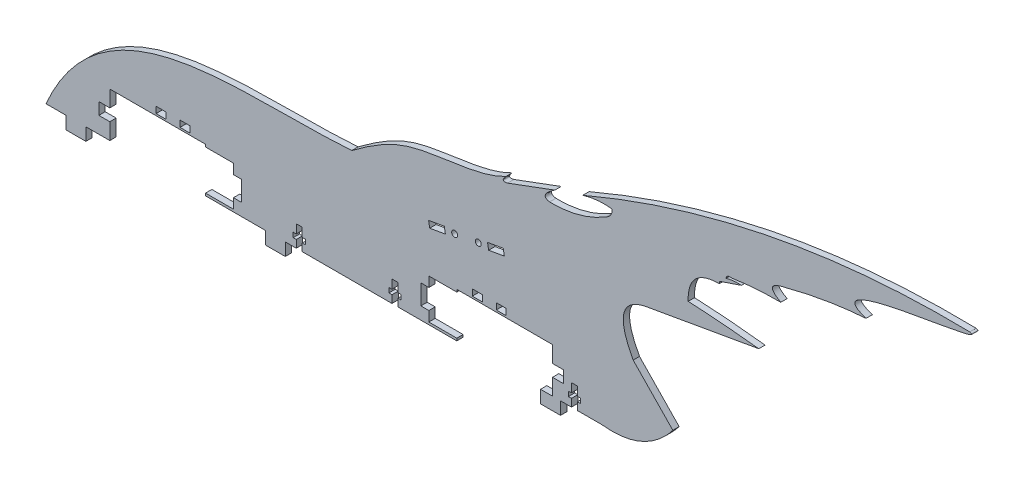
from build123d import *

# Parameters (mm, degrees)
BOSS_EXTRUDE1_DEPTH = 3.175
SKETCH3_W           = 10
SKETCH3_H           = 6.35
BOSS_EXTRUDE2_DEPTH = 3.175
CUT_EXTRUDE1_DEPTH  = 1
CUT_EXTRUDE2_DEPTH  = 309.914260869
SKETCH7_W           = 5
SKETCH7_H           = 3.175
CUT_EXTRUDE3_DEPTH  = 309.914260869
SKETCH8_R           = 1.5
CUT_EXTRUDE4_DEPTH  = 309.914260869


with BuildPart() as part:
    # Sketch2 → Boss-Extrude1 (new body)
    with BuildSketch(Plane.XY):
        with BuildLine():
            Line((-171.469047232, -34.076589663), (107.072734851, -34.076589663))
            add(Edge.make_bspline(
                [(107.072734851, -34.076589663), (128.968224532, -36.583015685), (142.892082906, -18.715522774)],
                knots=[0, 0, 0, 1, 1, 1], degree=2))
            Line((142.892082906, -18.715522774), (122.99960361, 1.8225486))
            add(Edge.make_bspline(
                [(129.812103759, 28.346921979), (110.367502019, 24.835662341), (122.99960361, 1.8225486)],
                knots=[0, 0, 0, 1, 1, 1], degree=2))
            Line((129.812103759, 28.346921979), (185.982982819, 38.244685161))
            add(Edge.make_bspline(
                [(150.588622768, 41.132714976), (168.332466646, 40.241827569), (185.982982819, 38.244685161)],
                knots=[0, 0, 0, 1, 1, 1], degree=2))
            add(Edge.make_bspline(
                [(166.211544782, 56.600045126), (150.111599454, 56.448151942), (150.588622768, 41.132714976)],
                knots=[0, 0, 0, 1, 1, 1], degree=2))
            Line((166.211544782, 56.600045126), (166.232711914, 57.669663084))
            Line((166.232711914, 57.669663084), (177.243348067, 61.403308501))
            add(Edge.make_bspline(
                [(177.243348067, 61.403308501), (173.339529375, 61.796609349), (169.627135034, 60.610840144)],
                knots=[0, 0, 0, 1, 1, 1], degree=2))
            add(Edge.make_bspline(
                [(169.627135034, 60.610840144), (169.762853876, 62.544945332), (172.402329475, 62.156522878)],
                knots=[0, 0, 0, 1, 1, 1], degree=2))
            add(Edge.make_bspline(
                [(172.402329475, 62.156522878), (184.617311888, 64.041519989), (197.029812567, 63.947302758)],
                knots=[0, 0, 0, 1, 1, 1], degree=2))
            add(Edge.make_bspline(
                [(197.029812567, 63.947302758), (187.73474396, 69.069639789), (198.964387884, 71.402059066)],
                knots=[0, 0, 0, 1, 1, 1], degree=2))
            add(Edge.make_bspline(
                [(198.964387884, 71.402059066), (219.003547299, 76.786528717), (239.76459105, 78.329887141)],
                knots=[0, 0, 0, 1, 1, 1], degree=2))
            add(Edge.make_bspline(
                [(291.780939868, 98.47138823), (303.090852198, 95.717715254), (210.844028254, 88.026417155), (239.76459105, 78.329887141)],
                knots=[0, 0, 0, 0, 1, 1, 1, 1], degree=3))
            add(Edge.make_bspline(
                [(291.780939868, 98.47138823), (190.608851514, 100.539390251), (97.737935683, 60.775941524)],
                knots=[0, 0, 0, 1, 1, 1], degree=2))
            add(Edge.make_bspline(
                [(97.737935683, 60.775941524), (104.92881908, 63.001143493), (112.379572637, 62.156522878)],
                knots=[0, 0, 0, 1, 1, 1], degree=2))
            add(Edge.make_bspline(
                [(112.379572637, 62.156522878), (112.730110756, 59.051830939), (109.55036868, 57.311722682)],
                knots=[0, 0, 0, 1, 1, 1], degree=2))
            add(Edge.make_bspline(
                [(109.55036868, 57.311722682), (96.530025853, 49.246897899), (81.058579137, 49.55282081)],
                knots=[0, 0, 0, 1, 1, 1], degree=2))
            add(Edge.make_bspline(
                [(81.058579137, 49.55282081), (75.642299748, 50.628036984), (83.696612356, 55.998318906)],
                knots=[0, 0, 0, 1, 1, 1], degree=2))
            Line((83.696612356, 55.998318906), (60.023408157, 47.198036308))
            add(Edge.make_bspline(
                [(60.023408157, 47.198036308), (56.150260782, 46.24516321), (59.12376331, 49.613311176)],
                knots=[0, 0, 0, 1, 1, 1], degree=2))
            add(Edge.make_bspline(
                [(59.12376331, 49.613311176), (44.292473838, 41.921501166), (13.209344651, 43.405332099), (-7.707186428, 29.993825045), (-18.106560521, 22.301338951)],
                knots=[0, 0, 0, 0, 0.606338938, 1, 1, 1, 1], degree=3))
            add(Edge.make_bspline(
                [(-18.106560521, 22.301338951), (-73.30010729, 18.178725753), (-142.381543794, 32.928841514), (-171.469047232, -34.076589663)],
                knots=[0, 0, 0, 0, 1, 1, 1, 1], degree=3))
        make_face()
    extrude(amount=BOSS_EXTRUDE1_DEPTH)

    # Sketch3 → Boss-Extrude2 (add)
    with BuildSketch(Plane.XY.offset(3.175)):
        with Locations((-156.469047232, -37.251589663)):
            Rectangle(SKETCH3_W, SKETCH3_H)
        with Locations((-56.469047232, -37.251589663)):
            Rectangle(SKETCH3_W, SKETCH3_H)
        with Locations((81.530952768, -37.251589663)):
            Rectangle(SKETCH3_W, SKETCH3_H)
    extrude(amount=-BOSS_EXTRUDE2_DEPTH)

    # Sketch4 → Cut-Extrude1 (cut)
    with BuildSketch(Plane.XY):
        with BuildLine():
            Line((-8.735344321, 21.076667257), (49.27249451, 25.443679203))
            add(Edge.make_bspline(
                [(55.435775055, 40.720887474), (56.710717132, 34.955549426), (51.7521577, 29.95185464), (49.27249451, 25.443679203)],
                knots=[0, 0, 0, 0, 1, 1, 1, 1], degree=3))
            add(Edge.make_bspline(
                [(55.435775055, 40.720887474), (33.054612951, 40.360145045), (7.874054379, 39.272954497), (-8.735344321, 21.076667257)],
                knots=[0, 0, 0, 0, 1, 1, 1, 1], degree=3))
        make_face()
    extrude(amount=CUT_EXTRUDE1_DEPTH, mode=Mode.SUBTRACT)

    # Sketch5 → Cut-Extrude2 (cut, through all)
    with BuildSketch(Plane.XY.offset(3.175)):
        Polygon((-45.969047232, -34.076589663), (-42.969047232, -34.076589663), (-42.969047232, -30.276589663), (-41.419047232, -30.276589663), (-41.419047232, -27.876589663), (-42.969047232, -27.876589663), (-42.969047232, -23.426589663), (-45.969047232, -23.426589663), (-45.969047232, -27.876589663), (-47.519047232, -27.876589663), (-47.519047232, -30.276589663), (-45.969047232, -30.276589663), align=None)
        Polygon((2.030952768, -30.276589663), (2.030952768, -34.076589663), (5.030952768, -34.076589663), (5.030952768, -30.276589663), (6.580952768, -30.276589663), (6.580952768, -27.876589663), (5.030952768, -27.876589663), (5.030952768, -23.426589663), (2.030952768, -23.426589663), (2.030952768, -27.876589663), (0.480952768, -27.876589663), (0.480952768, -30.276589663), align=None)
        Polygon((92.030952768, -30.276589663), (92.030952768, -34.076589663), (95.030952768, -34.076589663), (95.030952768, -30.276589663), (96.580952768, -30.276589663), (96.580952768, -27.876589663), (95.030952768, -27.876589663), (95.030952768, -23.426589663), (92.030952768, -23.426589663), (92.030952768, -27.876589663), (90.480952768, -27.876589663), (90.480952768, -30.276589663), align=None)
    extrude(amount=-CUT_EXTRUDE2_DEPTH, mode=Mode.SUBTRACT)

    # Sketch7 → Cut-Extrude3 (cut, through all)
    with BuildSketch(Plane.XY.offset(3.175)):
        Polygon((-91.469047232, -32.876589663), (-77.469047232, -32.876589663), (-77.469047232, -27.876589663), (-73.469047232, -27.876589663), (-73.469047232, -17.876589663), (-77.469047232, -17.876589663), (-77.469047232, -12.876589663), (-91.469047232, -12.876589663), (-91.469047232, -11.676589663), (-139.469047232, -11.676589663), (-139.469047232, -19.876589663), (-144.969047232, -19.876589663), (-144.969047232, -25.876589663), (-139.469047232, -25.876589663), (-139.469047232, -34.076589663), (-91.469047232, -34.076589663), align=None)
        Polygon((20.530952768, -27.876589663), (20.530952768, -32.876589663), (34.530952768, -32.876589663), (34.530952768, -34.076589663), (82.530952768, -34.076589663), (82.530952768, -25.876589663), (88.030952768, -25.876589663), (88.030952768, -19.876589663), (82.530952768, -19.876589663), (82.530952768, -11.676589663), (34.530952768, -11.676589663), (34.530952768, -12.876589663), (20.530952768, -12.876589663), (20.530952768, -17.876589663), (16.530952768, -17.876589663), (16.530952768, -27.876589663), align=None)
        with Locations((-113.769047232, -9.149089663)):
            Rectangle(SKETCH7_W, SKETCH7_H)
        with Locations((-101.769047232, -9.149089663)):
            Rectangle(SKETCH7_W, SKETCH7_H)
        with Locations((44.830952768, -9.149089663)):
            Rectangle(SKETCH7_W, SKETCH7_H)
        with Locations((56.830952768, -9.149089663)):
            Rectangle(SKETCH7_W, SKETCH7_H)
    extrude(amount=-CUT_EXTRUDE3_DEPTH, mode=Mode.SUBTRACT)

    # Sketch8 → Cut-Extrude4 (cut, through all)
    with BuildSketch(Plane(origin=(0, 0, 0), x_dir=(-1, 0, 0), z_dir=(0, 0, -1))):
        with Locations((-33.483463602, 11.904038041)):
            Circle(SKETCH8_R)
        with Locations(Location((-45.301156639, 13.987816173, 0), (0, 0, 180))):
            Circle(SKETCH8_R)
        Polygon((-20.405296331, 11.209994039), (-20.956629295, 8.083229423), (-28.835091319, 9.472414844), (-28.283758355, 12.59917946), align=None)
        Polygon((-49.949528922, 16.419439369), (-50.500861886, 13.292674753), (-58.37932391, 14.681860174), (-57.827990946, 17.80862479), align=None)
    extrude(amount=-CUT_EXTRUDE4_DEPTH, mode=Mode.SUBTRACT)


solid = part.part
